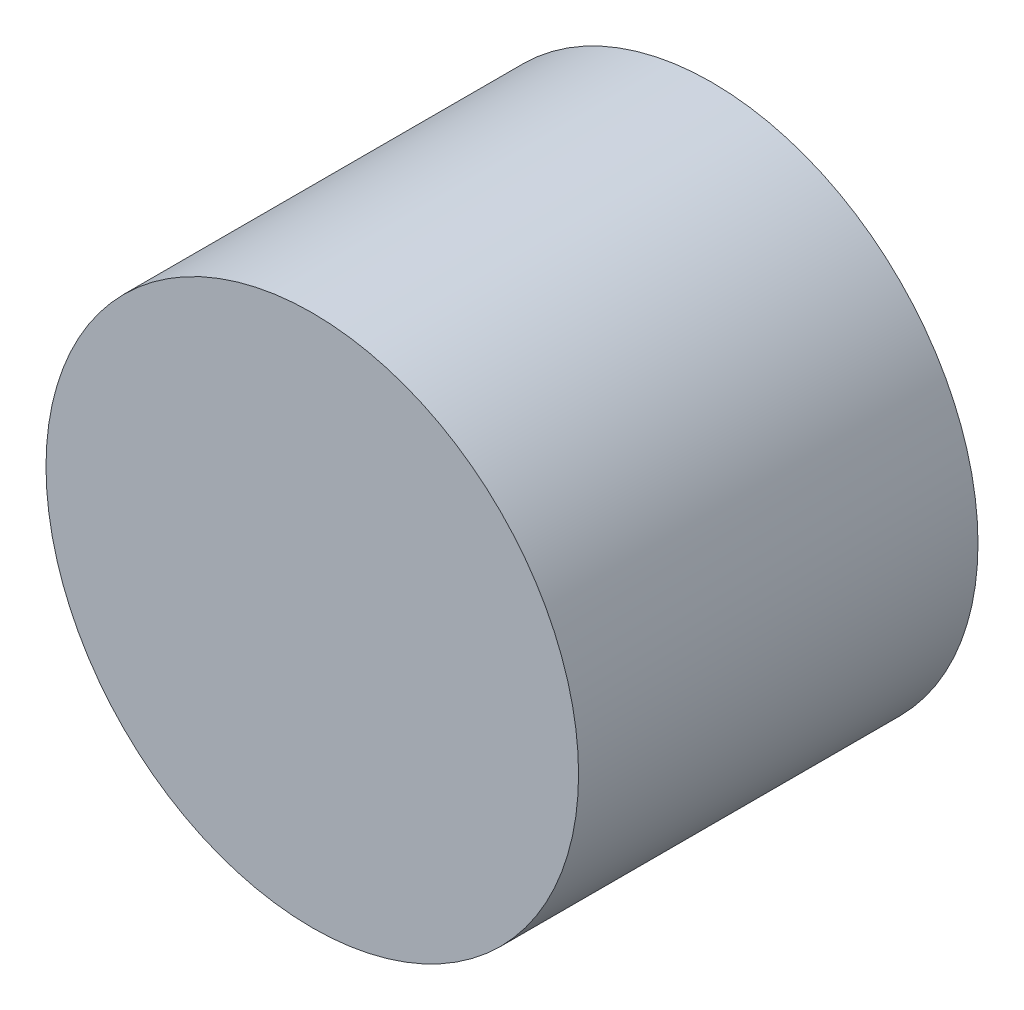
from build123d import *


with BuildPart() as part:
    # Sketch2 → Revolve3 (revolve)
    with BuildSketch(Plane(origin=(0, 0, 0), x_dir=(1, 0, 0), z_dir=(0, 1, 0))):
        with BuildLine():
            Line((-10, -10), (-10, 0))
            Line((-10, 0), (-20, 0))
            Line((-20, 0), (-20, -30))
            Line((-20, -30), (0, -30))
            Line((0, -30), (0, -20))
            ThreePointArc((0, -20), (-7.071067812, -17.071067812), (-10, -10))
        make_face()
    revolve(axis=Axis((0, 0, 0), (0, 0, 1)))


solid = part.part
